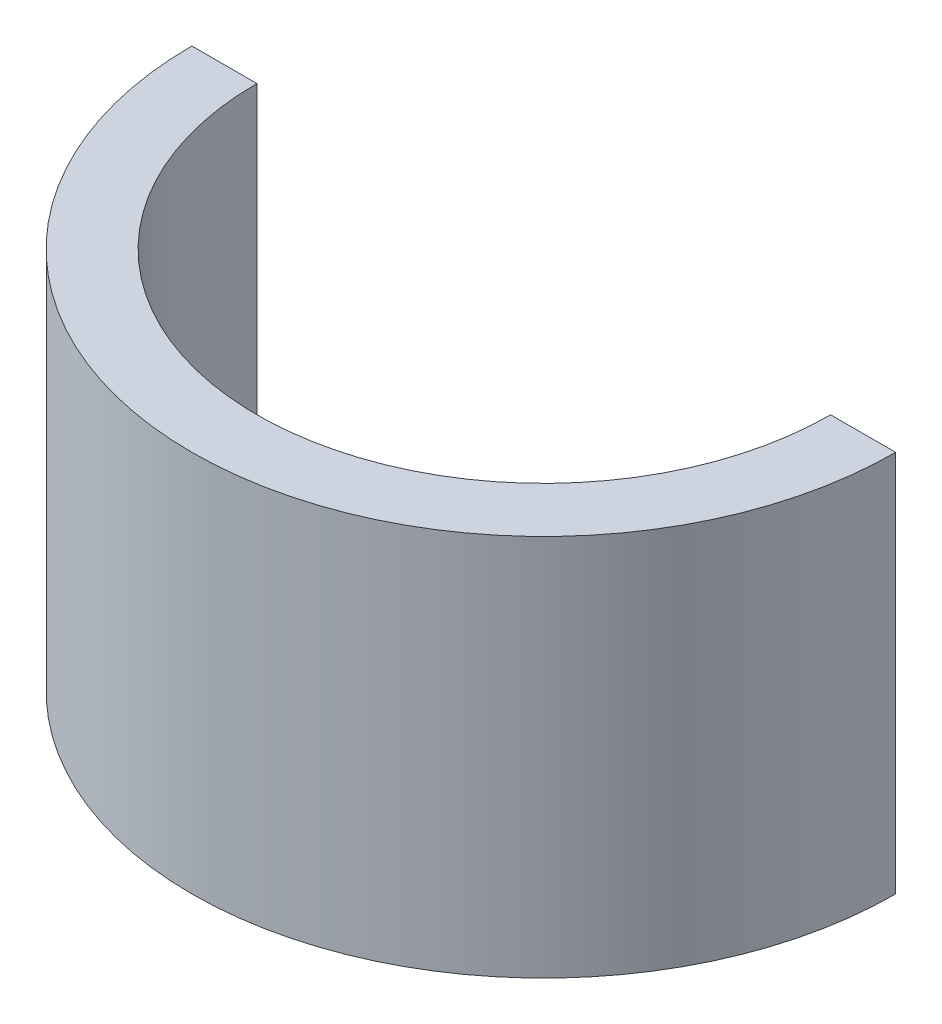
from build123d import *

# Parameters (mm, degrees)
SKETCH1_R               = 46
SKETCH1_R_2             = 37.5
BOSS_EXTRUDE1_DEPTH     = 50
CUT_EXTRUDE8_DEPTH      = 83.048765987
CUT_EXTRUDE8_DEPTH_BACK = 83.048765987
SKETCH8_W               = 104.25588027
SKETCH8_H               = 47.375265608


with BuildPart() as part:
    # Sketch1 → Boss-Extrude1 (new body)
    with BuildSketch(Plane(origin=(0, 0, 0), x_dir=(1, 0, 0), z_dir=(0, 1, 0))):
        with Locations(Location((0, 0, 0), (0, 0, 270))):
            Circle(SKETCH1_R)
        with Locations(Location((0, 0, 0), (0, 0, 270))):
            Circle(SKETCH1_R_2, mode=Mode.SUBTRACT)
    extrude(amount=BOSS_EXTRUDE1_DEPTH)

    # Sketch8 → Cut-Extrude8 (cut, two sides: drawn at the far end of the back side and taken through both)
    with BuildSketch(Plane(origin=(0, 50, 0), x_dir=(1, 0, 0), z_dir=(0, 1, 0)).offset(-CUT_EXTRUDE8_DEPTH_BACK)):
        with Locations((-2.199460807, 23.687632804)):
            Rectangle(SKETCH8_W, SKETCH8_H)
    extrude(amount=CUT_EXTRUDE8_DEPTH + CUT_EXTRUDE8_DEPTH_BACK, mode=Mode.SUBTRACT)


solid = part.part
